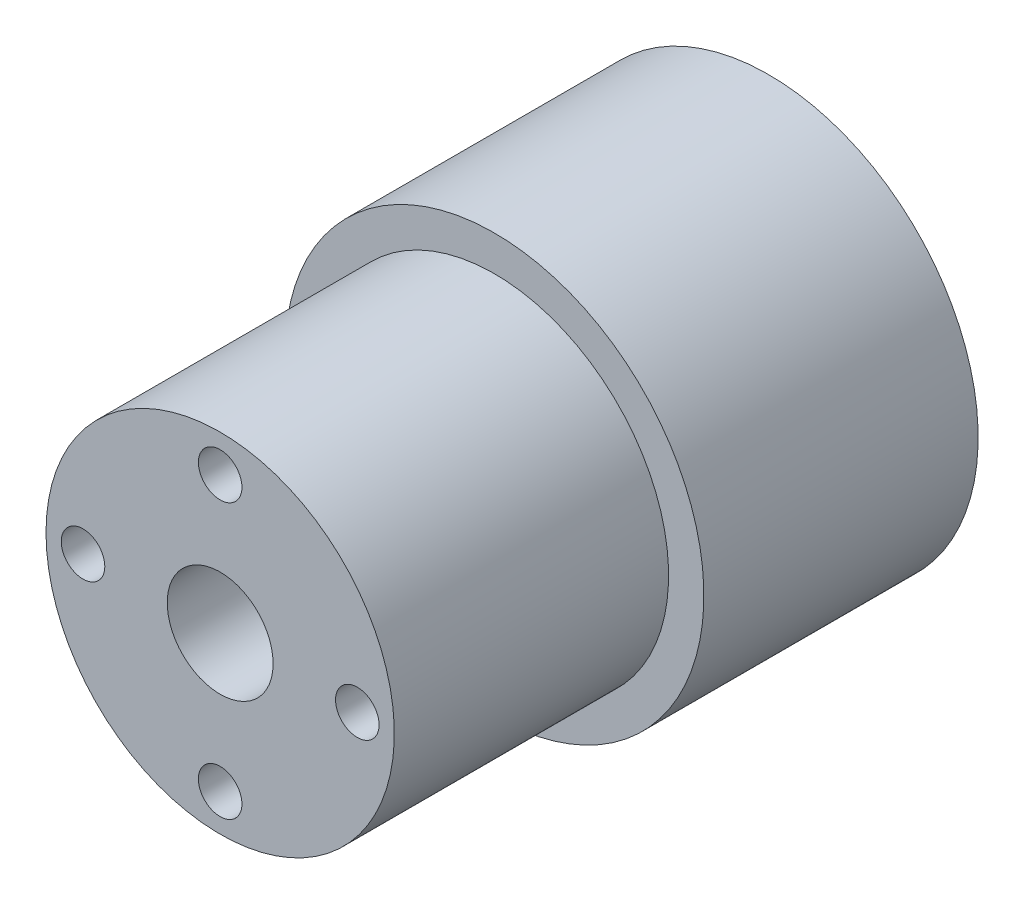
from build123d import *

# Parameters (mm, degrees)
SKETCH1_3_R        = 1.190625
CUT_EXTRUDE1_DEPTH = 8
SKETCH1_R          = 2.8956
CUT_EXTRUDE2_DEPTH = 16


with BuildPart() as part:
    # Sketch2 → Revolve1 (revolve)
    with BuildSketch(Plane.YZ):
        Polygon((0, 0), (9.525, 0), (9.525, -15), (11.455, -15), (11.455, -30), (0, -30), align=None)
    revolve(axis=Axis((0, 0, -30), (0, 0, 1)))

    # Sketch1<3> → Cut-Extrude1 (cut)
    with BuildSketch(Plane(origin=(0, 0, 0), x_dir=(0, 1, 0), z_dir=(0, 0, 1))):
        with Locations((0, 7.5)):
            Circle(SKETCH1_3_R)
        with Locations((-7.5, 0)):
            Circle(SKETCH1_3_R)
        with Locations((7.5, 0)):
            Circle(SKETCH1_3_R)
        with Locations((0, -7.5)):
            Circle(SKETCH1_3_R)
    extrude(amount=-CUT_EXTRUDE1_DEPTH, mode=Mode.SUBTRACT)

    # Sketch1 → Cut-Extrude2 (cut)
    with BuildSketch(Plane(origin=(0, 0, 0), x_dir=(0, 1, 0), z_dir=(0, 0, 1))):
        Circle(SKETCH1_R)
    extrude(amount=-CUT_EXTRUDE2_DEPTH, mode=Mode.SUBTRACT)


solid = part.part
